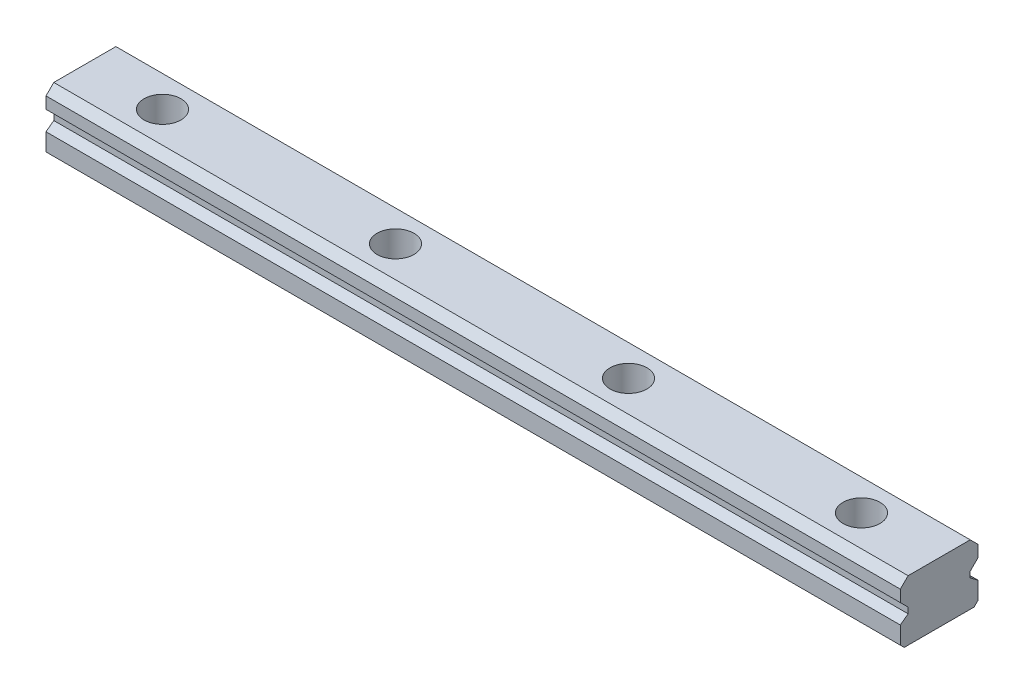
from build123d import *

# Parameters (mm, degrees)
BOSS_EXTRUDE1_DEPTH = 220
SKETCH2_R           = 4.75
CUT_EXTRUDE1_DEPTH  = 8.5
SKETCH3_R           = 3
CUT_EXTRUDE2_DEPTH  = 221.391129586
LPATTERN1_COUNT     = 4
LPATTERN1_PITCH     = 60


with BuildPart() as part:
    # Sketch1 → Boss-Extrude1 (new body)
    with BuildSketch(Plane(origin=(0, 0, 0), x_dir=(0, 0, -1), z_dir=(1, 0, 0))):
        Polygon((9, 0), (-9, 0), (-10, 1), (-10, 5.5), (-8, 7), (-8, 8.5), (-10, 10.5), (-10, 13.5), (-8, 15.5), (8, 15.5), (10, 13.5), (10, 10.5), (8, 8.5), (8, 7), (10, 5.5), (10, 1), align=None)
    extrude(amount=BOSS_EXTRUDE1_DEPTH)

    # Sketch2 → Cut-Extrude1 (cut)
    with BuildSketch(Plane(origin=(0, 15.5, 0), x_dir=(1, 0, 0), z_dir=(0, 1, 0))):
        with Locations(Location((20, 0, 0), (0, 0, 270))):
            Circle(SKETCH2_R)
    cut_extrude1 = extrude(amount=-CUT_EXTRUDE1_DEPTH, mode=Mode.SUBTRACT)

    # Sketch3 → Cut-Extrude2 (cut, through all)
    with BuildSketch(Plane(origin=(0, 7, 0), x_dir=(1, 0, 0), z_dir=(0, 1, 0))):
        with Locations(Location((20, 0, 0), (0, 0, 270))):
            Circle(SKETCH3_R)
    cut_extrude2 = extrude(amount=-CUT_EXTRUDE2_DEPTH, mode=Mode.SUBTRACT)

    # LPattern1: Cut-Extrude1, Cut-Extrude2 ×4
    with Locations(*[(i * LPATTERN1_PITCH, 0, 0) for i in range(1, LPATTERN1_COUNT)]):
        add(cut_extrude1, mode=Mode.SUBTRACT)
        add(cut_extrude2, mode=Mode.SUBTRACT)


solid = part.part
